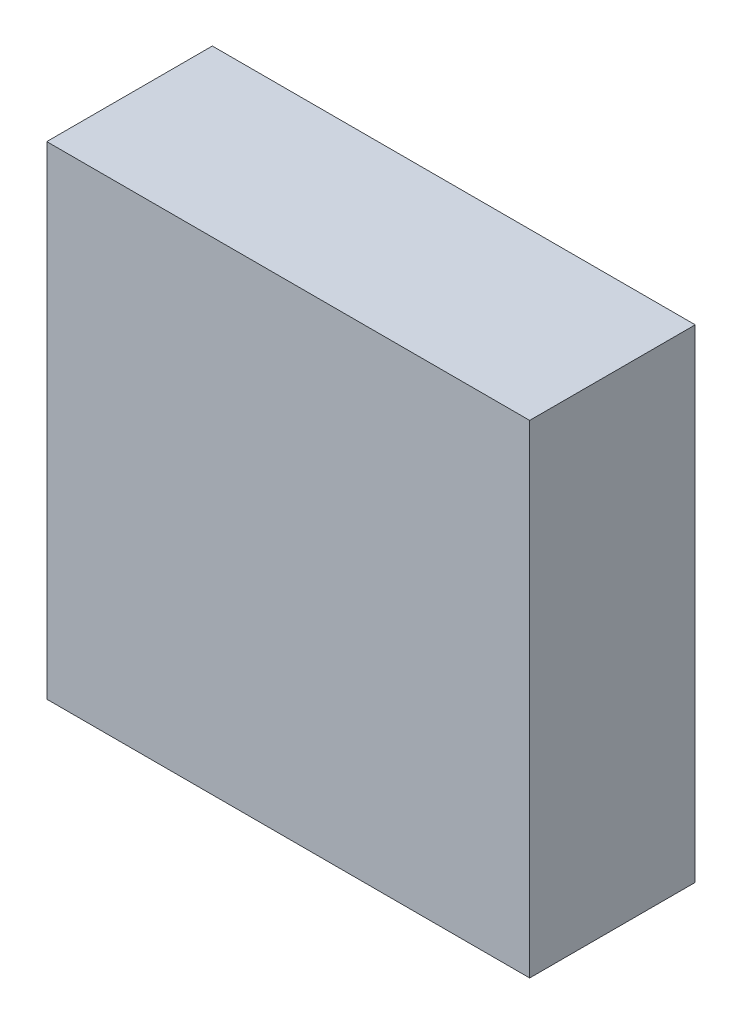
from build123d import *

# Parameters (mm, degrees)
SKETCH_1_W              = 3.5
SKETCH_1_H              = 3.5
COMPONENT_OUTLINE_DEPTH = 1.2


with BuildPart() as part:
    # 草图1 → Component_Outline (new body)
    with BuildSketch(Plane.XY):
        Rectangle(SKETCH_1_W, SKETCH_1_H)
    extrude(amount=COMPONENT_OUTLINE_DEPTH)


solid = part.part
